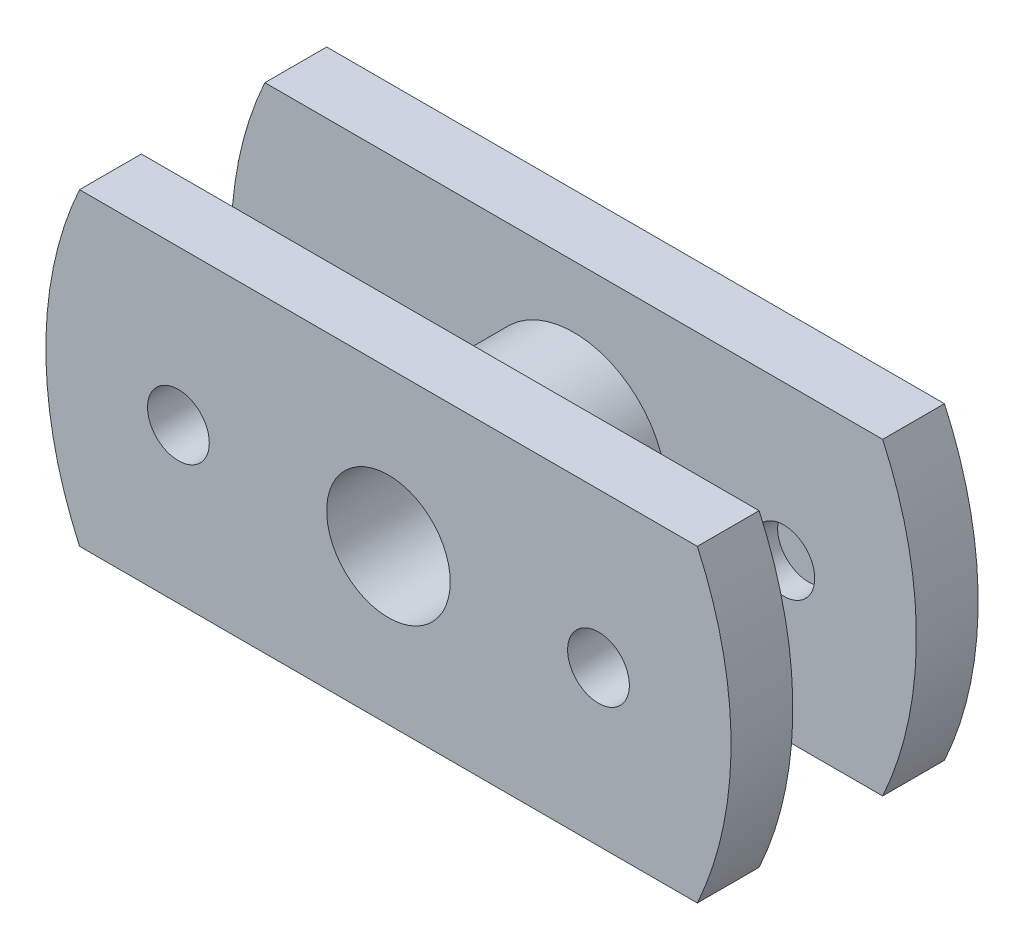
from build123d import *

# Parameters (mm, degrees)
BOSS_EXTRUDE1_DEPTH = 5
SKETCH2_R           = 7.5
BOSS_EXTRUDE2_DEPTH = 10
SKETCH3_R           = 2.5
CUT_EXTRUDE1_DEPTH  = 2
SKETCH4_R           = 7.5
BOSS_EXTRUDE3_DEPTH = 5
SKETCH6_R           = 7.5
BOSS_EXTRUDE4_DEPTH = 5
SKETCH7_R           = 5
CUT_EXTRUDE2_DEPTH  = 15
SKETCH8_R           = 2.5
CUT_EXTRUDE3_DEPTH  = 5


with BuildPart() as part:
    # Sketch1 → Boss-Extrude1 (new body)
    with BuildSketch(Plane.XY):
        with BuildLine():
            Line((-25, -12.5), (25, -12.5))
            ThreePointArc((25, -12.5), (27.728219713, 0), (25, 12.5))
            Line((25, 12.5), (-25, 12.5))
            ThreePointArc((-25, 12.5), (-27.728219713, 0), (-25, -12.5))
        make_face()
    extrude(amount=BOSS_EXTRUDE1_DEPTH)

    # Sketch2 → Boss-Extrude2 (add)
    with BuildSketch(Plane.XY.offset(5)):
        Circle(SKETCH2_R)
    extrude(amount=BOSS_EXTRUDE2_DEPTH)

    # Sketch3 → Cut-Extrude1 (cut)
    with BuildSketch(Plane.XY.offset(5)):
        with Locations((17, 0)):
            Circle(SKETCH3_R)
        with Locations((-17, 0)):
            Circle(SKETCH3_R)
    extrude(amount=-CUT_EXTRUDE1_DEPTH, mode=Mode.SUBTRACT)



with BuildPart() as body_2:
    # Sketch4 → Boss-Extrude3 (new body)
    with BuildSketch(Plane.XY.offset(15)):
        with BuildLine():
            Line((25, 12.5), (-25, 12.5))
            ThreePointArc((-25, 12.5), (-27.728219713, 0), (-25, -12.5))
            Line((-25, -12.5), (25, -12.5))
            ThreePointArc((25, -12.5), (27.728219713, 0), (25, 12.5))
        make_face()
        Circle(SKETCH4_R, mode=Mode.SUBTRACT)
    extrude(amount=BOSS_EXTRUDE3_DEPTH)


with BuildPart() as part_1:
    add(part.part)

    add(body_2.part)  # Boss-Extrude4 merges body 2
    # Sketch6 → Boss-Extrude4 (add)
    with BuildSketch(Plane.XY.offset(15)):
        Circle(SKETCH6_R)
    extrude(amount=BOSS_EXTRUDE4_DEPTH)

    # Sketch7 → Cut-Extrude2 (cut)
    with BuildSketch(Plane.XY.offset(20)):
        Circle(SKETCH7_R)
    extrude(amount=-CUT_EXTRUDE2_DEPTH, mode=Mode.SUBTRACT)

    # Sketch8 → Cut-Extrude3 (cut)
    with BuildSketch(Plane.XY.offset(20)):
        with Locations((17, 0)):
            Circle(SKETCH8_R)
        with Locations((-17, 0)):
            Circle(SKETCH8_R)
    extrude(amount=-CUT_EXTRUDE3_DEPTH, mode=Mode.SUBTRACT)


solid = part_1.part
